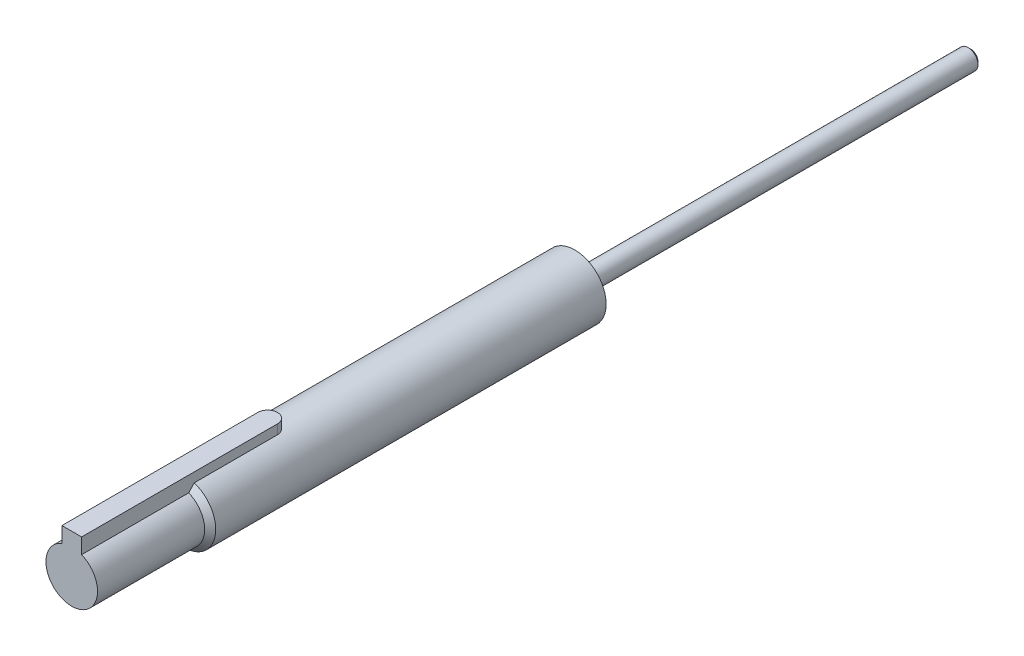
from build123d import *

# Parameters (mm, degrees)
BODY_KEY_DEPTH      = 9.9375
BOSS_EXTRUDE1_DEPTH = 27.16


with BuildPart() as part:
    # Sketch3 → Body (revolve)
    with BuildSketch(Plane(origin=(0, 0, 0), x_dir=(0, 0, -1), z_dir=(1, 0, 0)), mode=Mode.PRIVATE) as body_sk:
        Polygon((-31.75, 0), (68.625, 0), (68.625, 7.9375), (-30.350404591, 7.9375), (-31.75, 6.537904591), align=None)
    revolve(body_sk.sketch.rotate(Axis((0, 0, -80.9), (0, 0, 1)), 90), axis=Axis((0, 0, -80.9), (0, 0, 1)))

    # Sketch4 → Body-Back (revolve)
    with BuildSketch(Plane(origin=(0, 0, 0), x_dir=(0, 0, -1), z_dir=(1, 0, 0)), mode=Mode.PRIVATE) as body_back_sk:
        Polygon((68.625, 0), (68.625, 2.5), (168.330127019, 2.5), (169, 1.830127019), (169, 0), align=None)
    revolve(body_back_sk.sketch.rotate(Axis((0, 0, -80.9), (0, 0, 1)), 90), axis=Axis((0, 0, -80.9), (0, 0, 1)))

    # Sketch7 → Body-Key (add)
    with BuildSketch(Plane(origin=(0, 0, 0), x_dir=(1, 0, 0), z_dir=(0, 1, 0))):
        with BuildLine():
            Line((-2.5, -31.75), (2.5, -31.75))
            Line((2.5, -31.75), (2.5, -9.25))
            ThreePointArc((2.5, -9.25), (0, -6.75), (-2.5, -9.25))
            Line((-2.5, -9.25), (-2.5, -31.75))
        make_face()
    extrude(amount=BODY_KEY_DEPTH)

    # Sketch8 → Boss-Extrude1 (add)
    with BuildSketch(Plane.XY.offset(31.75)):
        with BuildLine():
            Line((2.5, 6.041042661), (2.5, 9.9375))
            Line((2.5, 9.9375), (-2.5, 9.9375))
            Line((-2.5, 9.9375), (-2.5, 6.041042661))
            ThreePointArc((-2.5, 6.041042661), (0, -6.537904591), (2.5, 6.041042661))
        make_face()
    extrude(amount=BOSS_EXTRUDE1_DEPTH)


solid = part.part
